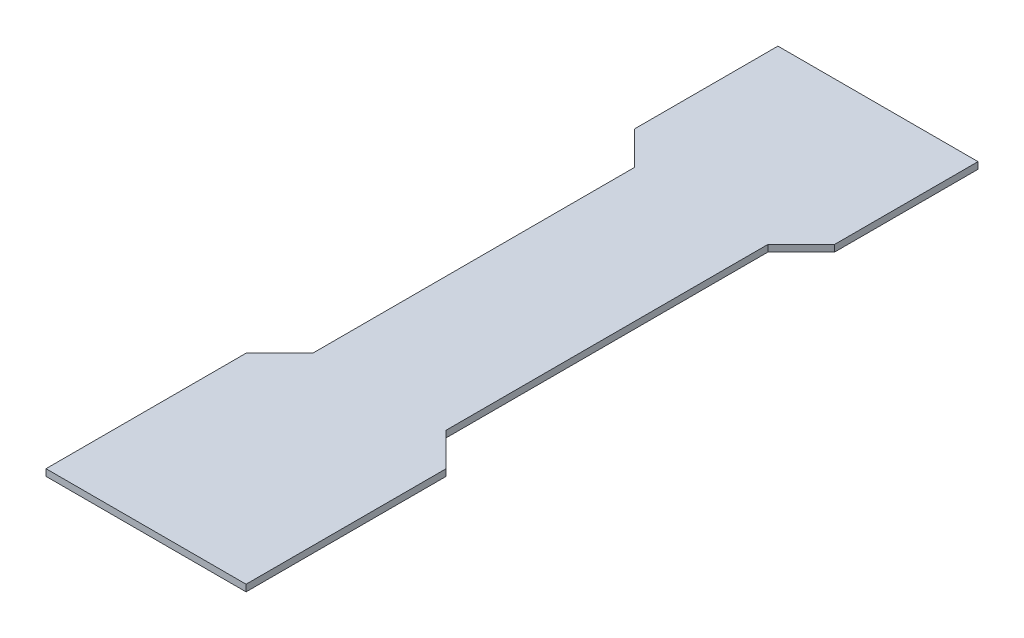
from build123d import *

# Parameters (mm, degrees)
EXTRUDE_1_DEPTH = 2


with BuildPart() as part:
    # 草图1 → 凸台-拉伸1 (new body)
    with BuildSketch(Plane(origin=(0, 0, 0), x_dir=(1, 0, 0), z_dir=(0, 1, 0))):
        Polygon((-30, -260), (-30, -320), (30, -320), (30, -260), (20, -250), (20, -240), (20, -153.5), (30, -143.5), (30, -100.5), (-30, -100.5), (-30, -143.5), (-20, -153.5), (-20, -240), (-20, -250), align=None)
    extrude(amount=EXTRUDE_1_DEPTH)


solid = part.part
